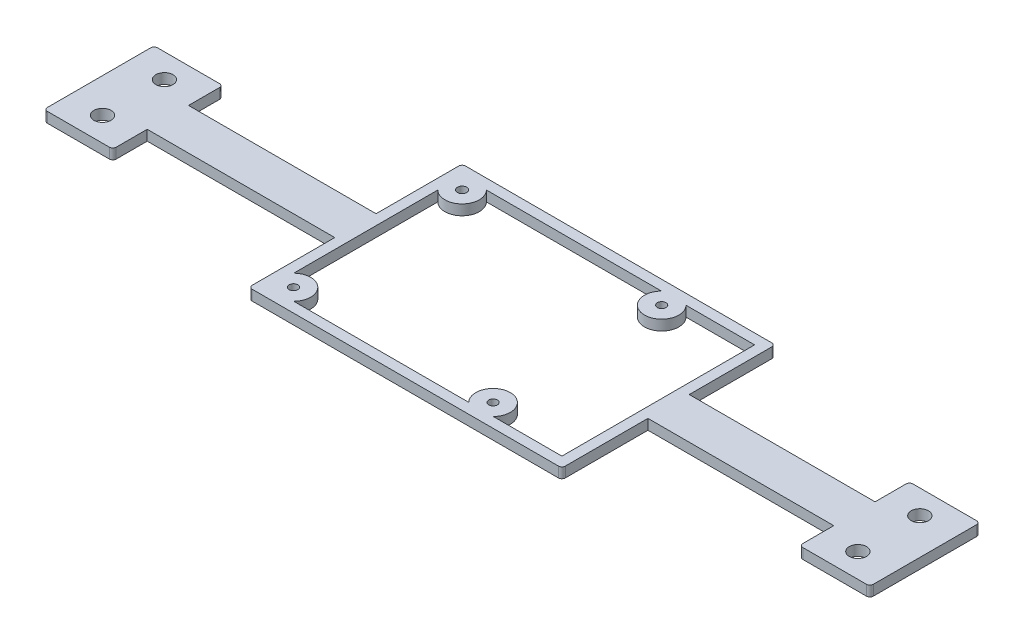
from build123d import *

# Parameters (mm, degrees)
SKETCH1_W           = 91
SKETCH1_H           = 62
BOSS_EXTRUDE3_DEPTH = 3
SKETCH2_W           = 85
SKETCH2_H           = 56
CUT_EXTRUDE1_DEPTH  = 3
SKETCH3_R           = 5
SKETCH3_R_2         = 1.25
SKETCH3_R_3         = 1.35
BOSS_EXTRUDE4_DEPTH = 3
SKETCH4_W           = 12
SKETCH4_H           = 3
BOSS_EXTRUDE5_DEPTH = 54.5
SKETCH5_W           = 20
SKETCH5_H           = 32
SKETCH5_R           = 2.5
BOSS_EXTRUDE6_DEPTH = 3
SKETCH6_W           = 12
SKETCH6_H           = 3
BOSS_EXTRUDE7_DEPTH = 54.5
SKETCH7_R           = 5
SKETCH7_R_2         = 1.25
BOSS_EXTRUDE8_DEPTH = 3
SKETCH8_W           = 20.5
SKETCH8_H           = 32
SKETCH8_R           = 2.5
BOSS_EXTRUDE9_DEPTH = 3
FILLET1_R           = 1


with BuildPart() as part:
    # Sketch1 → Boss-Extrude3 (new body)
    with BuildSketch(Plane(origin=(0, 0, 0), x_dir=(1, 0, 0), z_dir=(0, 1, 0))):
        with Locations((45.5, 31)):
            Rectangle(SKETCH1_W, SKETCH1_H)
    extrude(amount=BOSS_EXTRUDE3_DEPTH)

    # Sketch2 → Cut-Extrude1 (cut)
    with BuildSketch(Plane(origin=(0, 3, 0), x_dir=(1, 0, 0), z_dir=(0, 1, 0))):
        with Locations((45.5, 31)):
            Rectangle(SKETCH2_W, SKETCH2_H)
    extrude(amount=-CUT_EXTRUDE1_DEPTH, mode=Mode.SUBTRACT)

    # Sketch3 → Boss-Extrude4 (add)
    # profile 1 of 2: a face of its own
    with BuildSketch(Plane(origin=(0, 3, 0), x_dir=(1, 0, 0), z_dir=(0, 1, 0))):
        with Locations((6.5, 6.5)):
            Circle(SKETCH3_R)
        with Locations(Location((6.5, 6.5, 0), (0, 0, 270))):
            Circle(SKETCH3_R_2, mode=Mode.SUBTRACT)
    # profile 2 of 2: a face of its own
    with BuildSketch(Plane(origin=(0, 3, 0), x_dir=(1, 0, 0), z_dir=(0, 1, 0))):
        with Locations((6.5, 55.5)):
            Circle(SKETCH3_R)
        with Locations(Location((6.5, 55.5, 0), (0, 0, 270))):
            Circle(SKETCH3_R_3, mode=Mode.SUBTRACT)
    extrude(amount=-BOSS_EXTRUDE4_DEPTH)

    # Sketch4 → Boss-Extrude5 (add)
    with BuildSketch(Plane.ZY):
        with Locations((-31, 1.5)):
            Rectangle(SKETCH4_W, SKETCH4_H)
    extrude(amount=BOSS_EXTRUDE5_DEPTH)

    # Sketch5 → Boss-Extrude6 (add)
    with BuildSketch(Plane(origin=(0, 3, 0), x_dir=(1, 0, 0), z_dir=(0, 1, 0))):
        with Locations((-64.5, 31)):
            Rectangle(SKETCH5_W, SKETCH5_H)
        with Locations(Location((-64.5, 40, 0), (0, 0, 270))):
            Circle(SKETCH5_R, mode=Mode.SUBTRACT)
        with Locations(Location((-64.5, 22, 0), (0, 0, 270))):
            Circle(SKETCH5_R, mode=Mode.SUBTRACT)
    extrude(amount=-BOSS_EXTRUDE6_DEPTH)

    # Sketch6 → Boss-Extrude7 (add)
    with BuildSketch(Plane(origin=(91, 0, 0), x_dir=(0, 0, -1), z_dir=(1, 0, 0))):
        with Locations((31, 1.5)):
            Rectangle(SKETCH6_W, SKETCH6_H)
    extrude(amount=BOSS_EXTRUDE7_DEPTH)

    # Sketch7 → Boss-Extrude8 (add)
    # profile 1 of 2: a face of its own
    with BuildSketch(Plane(origin=(0, 3, 0), x_dir=(1, 0, 0), z_dir=(0, 1, 0))):
        with Locations((64.5, 55.5)):
            Circle(SKETCH7_R)
        with Locations(Location((64.5, 55.5, 0), (0, 0, 270))):
            Circle(SKETCH7_R_2, mode=Mode.SUBTRACT)
    # profile 2 of 2: a face of its own
    with BuildSketch(Plane(origin=(0, 3, 0), x_dir=(1, 0, 0), z_dir=(0, 1, 0))):
        with Locations((64.5, 6.5)):
            Circle(SKETCH7_R)
        with Locations(Location((64.5, 6.5, 0), (0, 0, 270))):
            Circle(SKETCH7_R_2, mode=Mode.SUBTRACT)
    extrude(amount=-BOSS_EXTRUDE8_DEPTH)

    # Sketch8 → Boss-Extrude9 (add)
    with BuildSketch(Plane(origin=(0, 3, 0), x_dir=(1, 0, 0), z_dir=(0, 1, 0))):
        with Locations((155.25, 31)):
            Rectangle(SKETCH8_W, SKETCH8_H)
        with Locations(Location((155, 40, 0), (0, 0, 270))):
            Circle(SKETCH8_R, mode=Mode.SUBTRACT)
        with Locations(Location((155, 22, 0), (0, 0, 270))):
            Circle(SKETCH8_R, mode=Mode.SUBTRACT)
    extrude(amount=-BOSS_EXTRUDE9_DEPTH)

    # Fillet1
    fillet1_edges = [part.edges().sort_by_distance(p)[0] for p in [
        (145, 1.5, -15),
        (145, 1.5, -47),
        (165.5, 1.5, -47),
        (165.5, 1.5, -15),
        (-54.5, 1.5, -47),
        (-54.5, 1.5, -15),
        (-74.5, 1.5, -15),
        (-74.5, 1.5, -47),
        (0, 1.5, -62),
        (91, 1.5, -62),
        (91, 1.5, 0),
        (0, 1.5, 0),
    ]]
    fillet(fillet1_edges, radius=FILLET1_R)


solid = part.part
